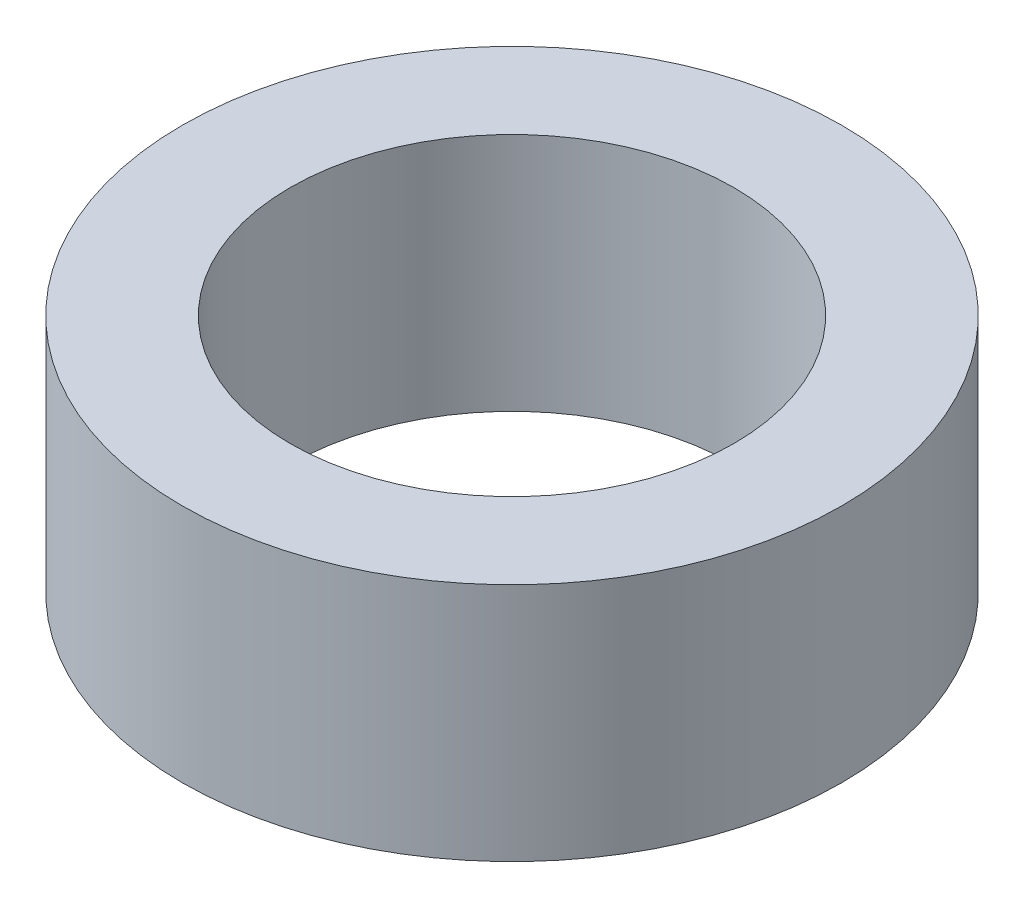
from build123d import *

# Parameters (mm, degrees)
SKETCH1_R           = 6.985
SKETCH1_R_2         = 4.699
BOSS_EXTRUDE1_DEPTH = 5.08


with BuildPart() as part:
    # Sketch1 → Boss-Extrude1 (new body)
    with BuildSketch(Plane(origin=(0, 0, 0), x_dir=(1, 0, 0), z_dir=(0, 1, 0))):
        with Locations(Location((0, 0, 0), (0, 0, 270))):
            Circle(SKETCH1_R)
        with Locations(Location((0, 0, 0), (0, 0, 270))):
            Circle(SKETCH1_R_2, mode=Mode.SUBTRACT)
    extrude(amount=BOSS_EXTRUDE1_DEPTH)


solid = part.part
